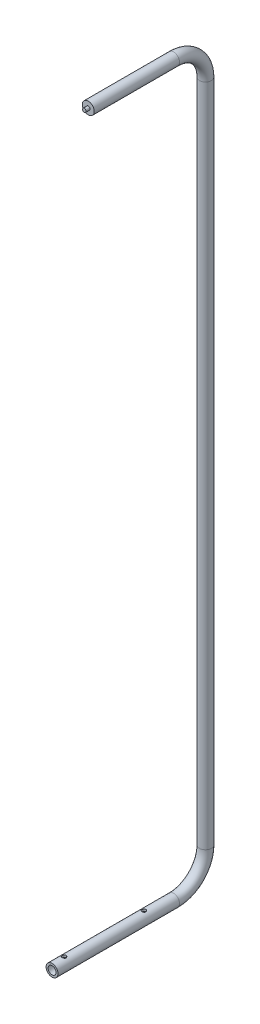
from build123d import *

# Parameters (mm, degrees)
SKETCH2_R           = 15
SKETCH2_R_2         = 10
SKETCH5_R           = 5
CUT_EXTRUDE2_DEPTH  = 158.5
SKETCH6_R           = 30
CUT_EXTRUDE3_DEPTH  = 90.8
SKETCH9_R           = 10
BOSS_EXTRUDE2_DEPTH = 211.8
SKETCH10_R          = 4.5
BOSS_EXTRUDE3_DEPTH = 10


with BuildPart() as part:
    # Sweep2: sweep along a path in Sketch1
    with BuildLine(Plane(origin=(0, 0, 0), x_dir=(0, 0, -1), z_dir=(1, 0, 0))) as sweep2_path:
        Line((0, 0), (304.8, 0))
        ThreePointArc((304.8, 0), (361.368542495, 23.431457505), (384.8, 80))
        Line((384.8, 80), (384.8, 1748.2))
        ThreePointArc((384.8, 1748.2), (361.368542495, 1804.768542495), (304.8, 1828.2))
        Line((304.8, 1828.2), (0, 1828.2))
    # Sketch2 → Sweep2 (sweep)
    with BuildSketch(Plane.XY):
        with Locations((0, 1828.2)):
            Circle(SKETCH2_R)
        with Locations((0, 1828.2)):
            Circle(SKETCH2_R_2, mode=Mode.SUBTRACT)
    sweep(path=sweep2_path.line)

    # Sketch5 → Cut-Extrude2 (cut, symmetric)
    with BuildSketch(Plane(origin=(0, 0, 0), x_dir=(1, 0, 0), z_dir=(0, 1, 0))):
        with Locations(Location((0, 30, 0), (0, 0, 270))):
            Circle(SKETCH5_R)
        with Locations(Location((0, 230, 0), (0, 0, 270))):
            Circle(SKETCH5_R)
    extrude(amount=CUT_EXTRUDE2_DEPTH, both=True, mode=Mode.SUBTRACT)

    # Sketch6 → Cut-Extrude3 (cut)
    with BuildSketch(Plane.XY):
        with Locations((0, 1828.2)):
            Circle(SKETCH6_R)
    extrude(amount=-CUT_EXTRUDE3_DEPTH, mode=Mode.SUBTRACT)

    # Sketch9 → Boss-Extrude2 (add)
    with BuildSketch(Plane.XY.offset(-90.8)):
        with Locations((0, 1828.2)):
            Circle(SKETCH9_R)
    extrude(amount=-BOSS_EXTRUDE2_DEPTH)

    # Sketch10 → Boss-Extrude3 (add)
    with BuildSketch(Plane.XY.offset(-90.8)):
        with Locations((0, 1828.2)):
            Circle(SKETCH10_R)
    extrude(amount=BOSS_EXTRUDE3_DEPTH)


solid = part.part
